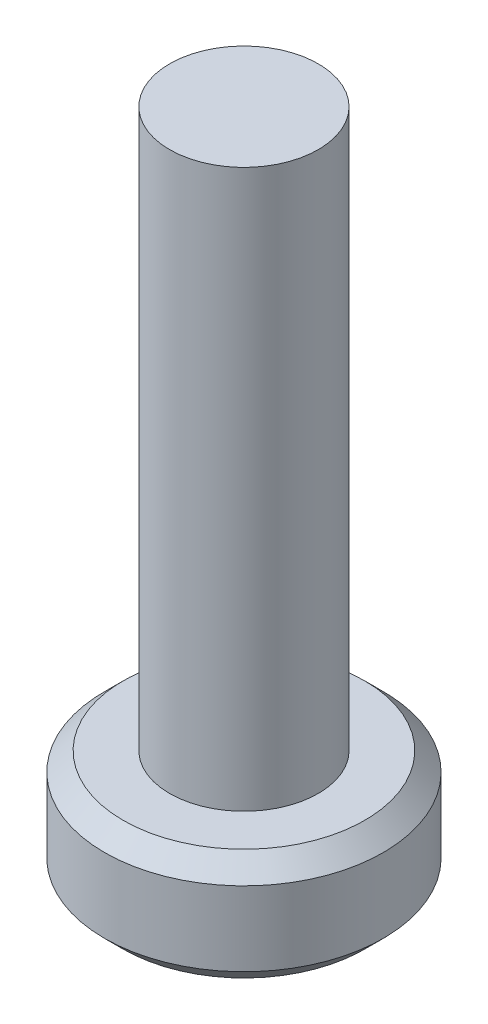
from build123d import *

# Parameters (mm, degrees)
SKETCH_1_R          = 3.75
EXTRUDE_1_DEPTH     = 3
SKETCH_2_R          = 2
EXTRUDE_2_DEPTH     = 15
CHAMFER_1_SIZE      = 0.5
CUT_EXTRUDE_1_DEPTH = 1


with BuildPart() as part:
    # 草图1 → 凸台-拉伸1 (new body)
    with BuildSketch(Plane(origin=(0, 0, 0), x_dir=(1, 0, 0), z_dir=(0, 1, 0))):
        with Locations(Location((0, 0, 0), (0, 0, 270))):
            Circle(SKETCH_1_R)
    extrude(amount=EXTRUDE_1_DEPTH)

    # 草图2 → 凸台-拉伸2 (add)
    with BuildSketch(Plane(origin=(0, 3, 0), x_dir=(1, 0, 0), z_dir=(0, 1, 0))):
        with Locations(Location((0, 0, 0), (0, 0, 270))):
            Circle(SKETCH_2_R)
    extrude(amount=EXTRUDE_2_DEPTH)

    # 倒角1
    chamfer_1_edges = [part.edges().sort_by_distance(p)[0] for p in [
        (0, 0, -3.75),
        (0, 3, -3.75),
    ]]
    chamfer(chamfer_1_edges, length=CHAMFER_1_SIZE)

    # 草图3 → 切除-拉伸1 (cut)
    with BuildSketch(Plane.XZ):
        Polygon((0, -2.886751346), (2.5, -1.443375673), (2.5, 1.443375673), (0, 2.886751346), (-2.5, 1.443375673), (-2.5, -1.443375673), align=None)
    extrude(amount=-CUT_EXTRUDE_1_DEPTH, mode=Mode.SUBTRACT)


solid = part.part
